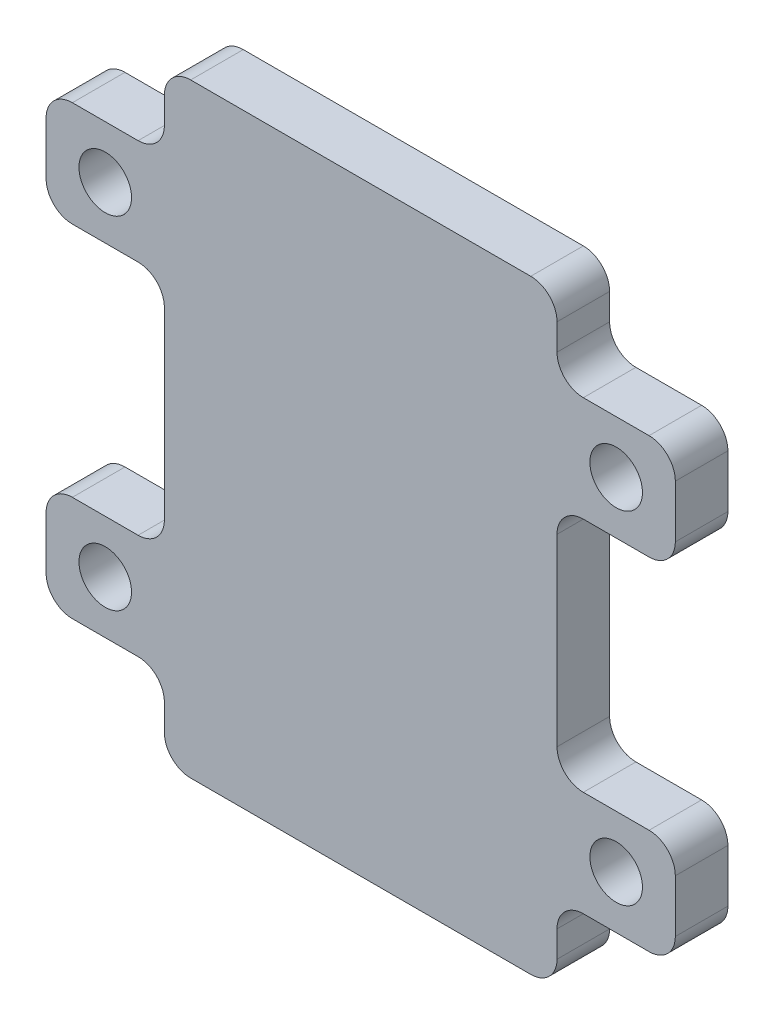
from build123d import *

# Parameters (mm, degrees)
SKETCH1_R           = 0.5
BOSS_EXTRUDE1_DEPTH = 1


with BuildPart() as part:
    # Sketch1 → Boss-Extrude1 (new body)
    with BuildSketch(Plane.XY):
        with BuildLine():
            Line((-3.734024834, 11), (-3.734024834, 10.5))
            ThreePointArc((-3.734024834, 10.5), (-3.880471443, 10.146446609), (-4.234024834, 10))
            Line((-4.234024834, 10), (-5.484024834, 10))
            ThreePointArc((-5.484024834, 10), (-5.837578224, 9.853553391), (-5.984024834, 9.5))
            Line((-5.984024834, 9.5), (-5.984024834, 8.5))
            ThreePointArc((-5.984024834, 8.5), (-5.837578224, 8.146446609), (-5.484024834, 8))
            Line((-5.484024834, 8), (-4.234024834, 8))
            ThreePointArc((-4.234024834, 8), (-3.880471443, 7.853553391), (-3.734024834, 7.5))
            Line((-3.734024834, 7.5), (-3.734024834, 4))
            ThreePointArc((-3.734024834, 4), (-3.880471443, 3.646446609), (-4.234024834, 3.5))
            Line((-4.234024834, 3.5), (-5.484024834, 3.5))
            ThreePointArc((-5.484024834, 3.5), (-5.837578224, 3.353553391), (-5.984024834, 3))
            Line((-5.984024834, 3), (-5.984024834, 2))
            ThreePointArc((-5.984024834, 2), (-5.837578224, 1.646446609), (-5.484024834, 1.5))
            Line((-5.484024834, 1.5), (-4.234024834, 1.5))
            ThreePointArc((-4.234024834, 1.5), (-3.880471443, 1.353553391), (-3.734024834, 1))
            Line((-3.734024834, 1), (-3.734024834, 0.5))
            ThreePointArc((-3.734024834, 0.5), (-3.587578224, 0.146446609), (-3.234024834, 0))
            Line((-3.234024834, 0), (3.234024834, 0))
            ThreePointArc((3.234024834, 0), (3.587578224, 0.146446609), (3.734024834, 0.5))
            Line((3.734024834, 0.5), (3.734024834, 1))
            ThreePointArc((3.734024834, 1), (3.880471443, 1.353553391), (4.234024834, 1.5))
            Line((4.234024834, 1.5), (5.484024834, 1.5))
            ThreePointArc((5.484024834, 1.5), (5.837578224, 1.646446609), (5.984024834, 2))
            Line((5.984024834, 2), (5.984024834, 3))
            ThreePointArc((5.984024834, 3), (5.837578224, 3.353553391), (5.484024834, 3.5))
            Line((5.484024834, 3.5), (4.234024834, 3.5))
            ThreePointArc((4.234024834, 3.5), (3.880471443, 3.646446609), (3.734024834, 4))
            Line((3.734024834, 4), (3.734024834, 7.5))
            ThreePointArc((3.734024834, 7.5), (3.880471443, 7.853553391), (4.234024834, 8))
            Line((4.234024834, 8), (5.484024834, 8))
            ThreePointArc((5.484024834, 8), (5.837578224, 8.146446609), (5.984024834, 8.5))
            Line((5.984024834, 8.5), (5.984024834, 9.5))
            ThreePointArc((5.984024834, 9.5), (5.837578224, 9.853553391), (5.484024834, 10))
            Line((5.484024834, 10), (4.234024834, 10))
            ThreePointArc((4.234024834, 10), (3.880471443, 10.146446609), (3.734024834, 10.5))
            Line((3.734024834, 10.5), (3.734024834, 11))
            ThreePointArc((3.734024834, 11), (3.587578224, 11.353553391), (3.234024834, 11.5))
            Line((3.234024834, 11.5), (-3.234024834, 11.5))
            ThreePointArc((-3.234024834, 11.5), (-3.587578224, 11.353553391), (-3.734024834, 11))
        make_face()
        with Locations((-4.859024834, 9)):
            Circle(SKETCH1_R, mode=Mode.SUBTRACT)
        with Locations((-4.859024834, 2.5)):
            Circle(SKETCH1_R, mode=Mode.SUBTRACT)
        with Locations(Location((4.859024834, 2.5, 0), (0, 0, 180))):
            Circle(SKETCH1_R, mode=Mode.SUBTRACT)
        with Locations(Location((4.859024834, 9, 0), (0, 0, 180))):
            Circle(SKETCH1_R, mode=Mode.SUBTRACT)
    extrude(amount=BOSS_EXTRUDE1_DEPTH)


solid = part.part
